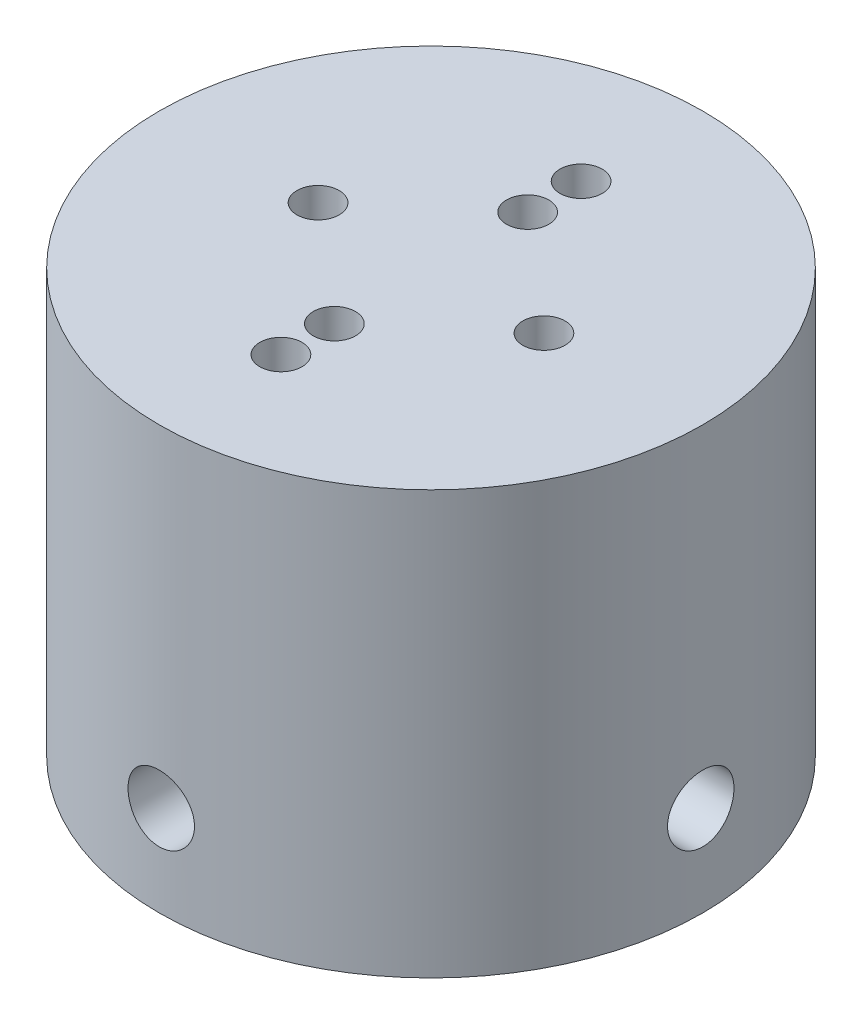
from build123d import *

# Parameters (mm, degrees)
SKETCH1_R               = 22.5
BOSS_EXTRUDE1_DEPTH     = 17.5
SKETCH2_R               = 17.5
CUT_EXTRUDE1_DEPTH      = 25
CUT_EXTRUDE2_DEPTH      = 37.314597616
CUT_EXTRUDE2_DEPTH_BACK = 37.314597616
SKETCH3_R               = 2.75
CUT_EXTRUDE3_DEPTH      = 37.314597788
CUT_EXTRUDE3_DEPTH_BACK = 37.314597788
SKETCH4_R               = 2.75
SKETCH5_R               = 1.75
CUT_EXTRUDE4_DEPTH      = 10


with BuildPart() as part:
    # Sketch1 → Boss-Extrude1 (new, symmetric)
    with BuildSketch(Plane(origin=(0, 0, 0), x_dir=(1, 0, 0), z_dir=(0, 1, 0))):
        with Locations(Location((0, 0, 0), (0, 0, 270))):
            Circle(SKETCH1_R)
    extrude(amount=BOSS_EXTRUDE1_DEPTH, both=True)

    # Sketch2 → Cut-Extrude1 (cut)
    with BuildSketch(Plane.XZ.offset(17.5)):
        with Locations(Location((0, 0, 0), (0, 0, 270))):
            Circle(SKETCH2_R)
    extrude(amount=-CUT_EXTRUDE1_DEPTH, mode=Mode.SUBTRACT)

    # Sketch3 → Cut-Extrude2 (cut, two sides: drawn at the far end of the back side and taken through both)
    with BuildSketch(Plane(origin=(0, 0, 0), x_dir=(0, 0, -1), z_dir=(1, 0, 0)).offset(-CUT_EXTRUDE2_DEPTH_BACK)):
        with Locations((0, -10)):
            Circle(SKETCH3_R)
    extrude(amount=CUT_EXTRUDE2_DEPTH + CUT_EXTRUDE2_DEPTH_BACK, mode=Mode.SUBTRACT)

    # Sketch4 → Cut-Extrude3 (cut, two sides: drawn at the far end of the back side and taken through both)
    with BuildSketch(Plane.XY.offset(-CUT_EXTRUDE3_DEPTH_BACK)):
        with Locations((0, -10)):
            Circle(SKETCH4_R)
    extrude(amount=CUT_EXTRUDE3_DEPTH + CUT_EXTRUDE3_DEPTH_BACK, mode=Mode.SUBTRACT)

    # Sketch5 → Cut-Extrude4 (cut)
    with BuildSketch(Plane(origin=(0, 17.5, 0), x_dir=(1, 0, 0), z_dir=(0, 1, 0))):
        with Locations(Location((0, 12.425, 0), (0, 0, 270))):
            Circle(SKETCH5_R)
        with Locations(Location((0, 8, 0), (0, 0, 270))):
            Circle(SKETCH5_R)
        with Locations(Location((0, -8, 0), (0, 0, 90))):
            Circle(SKETCH5_R)
        with Locations(Location((0, -12.425, 0), (0, 0, 90))):
            Circle(SKETCH5_R)
        with Locations(Location((-9.35, 0, 0), (0, 0, 270))):
            Circle(SKETCH5_R)
        with Locations(Location((9.35, 0, 0), (0, 0, 270))):
            Circle(SKETCH5_R)
    extrude(amount=-CUT_EXTRUDE4_DEPTH, mode=Mode.SUBTRACT)


solid = part.part
